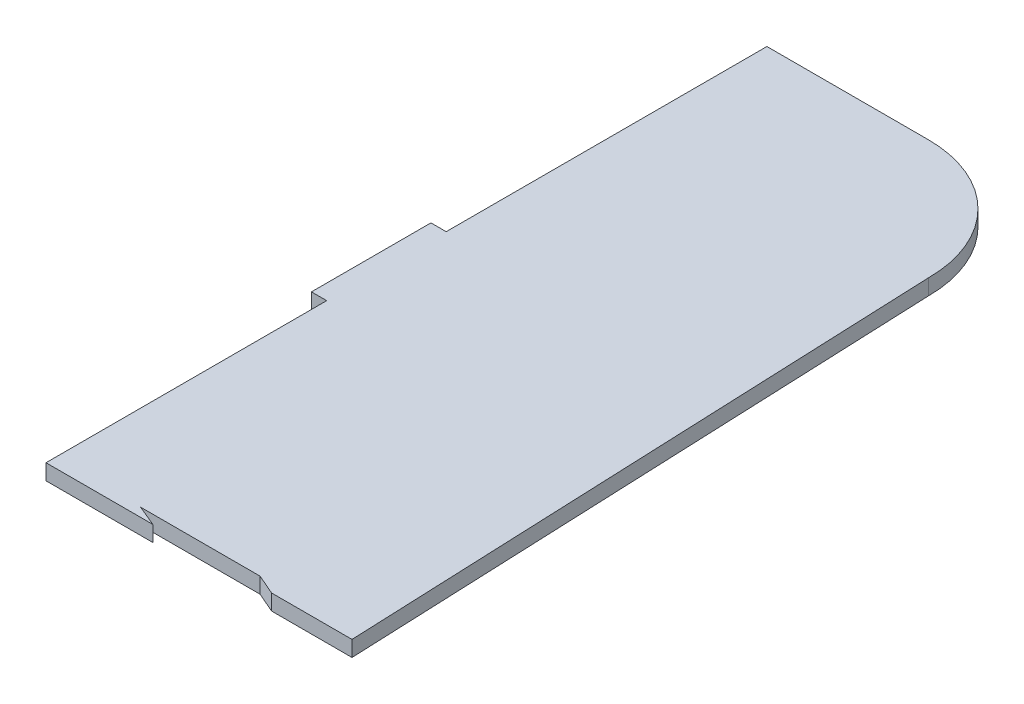
from build123d import *

# Parameters (mm, degrees)
BOSS_EXTRUDE1_DEPTH = 459.74
SKETCH3_W           = 117.668752198
SKETCH3_H           = 459.74
CUT_EXTRUDE1_DEPTH  = 10
SKETCH4_W           = 9.725175386
SKETCH4_H           = 179.007339898
SKETCH4_H_2         = 204.532660102
CUT_EXTRUDE3_DEPTH  = 63


with BuildPart() as part:
    # Sketch1 → Boss-Extrude1 (new body)
    with BuildSketch(Plane.XY):
        Polygon((358.121789204, 754.380000017), (137.961261276, 754.380000017), (137.961261276, 744.380000017), (562.803601281, 744.380000017), (562.803601281, 754.380000017), align=None)
    extrude(amount=BOSS_EXTRUDE1_DEPTH)

    # Sketch3 → Cut-Extrude1 (cut)
    with BuildSketch(Plane.XZ.offset(-744.380000017)):
        with Locations((196.795637375, 229.87)):
            Rectangle(SKETCH3_W, SKETCH3_H)
    extrude(amount=-CUT_EXTRUDE1_DEPTH, mode=Mode.SUBTRACT)

    # Sketch4 → Cut-Extrude3 (cut)
    with BuildSketch(Plane(origin=(0, 754.380000017, 0), x_dir=(1, 0, 0), z_dir=(0, 1, 0))):
        with Locations((260.492601167, -370.236330051)):
            Rectangle(SKETCH4_W, SKETCH4_H)
        with Locations((260.492601167, -102.266330051)):
            Rectangle(SKETCH4_W, SKETCH4_H_2)
        with BuildLine():
            Line((333.464234552, -459.74), (369.761877542, -561.839328351))
            Line((369.761877542, -561.839328351), (604.247212907, -525.668487146))
            Line((604.247212907, -525.668487146), (681.481358703, 161.10923172))
            Line((681.481358703, 161.10923172), (358.740146189, 101.846462791))
            Line((358.740146189, 101.846462791), (368.405121491, 0))
            ThreePointArc((368.405121491, 0), (422.286658217, -22.318463274), (444.605121491, -76.2))
            Line((444.605121491, -76.2), (460.501916297, -459.74))
            Line((460.501916297, -459.74), (409.216807378, -459.74))
            Line((409.216807378, -459.74), (396.253804705, -454.112660102))
            Line((396.253804705, -454.112660102), (320.053804705, -454.112660102))
            Line((320.053804705, -454.112660102), (333.464234552, -459.74))
        make_face()
    extrude(amount=-CUT_EXTRUDE3_DEPTH, mode=Mode.SUBTRACT)


solid = part.part
